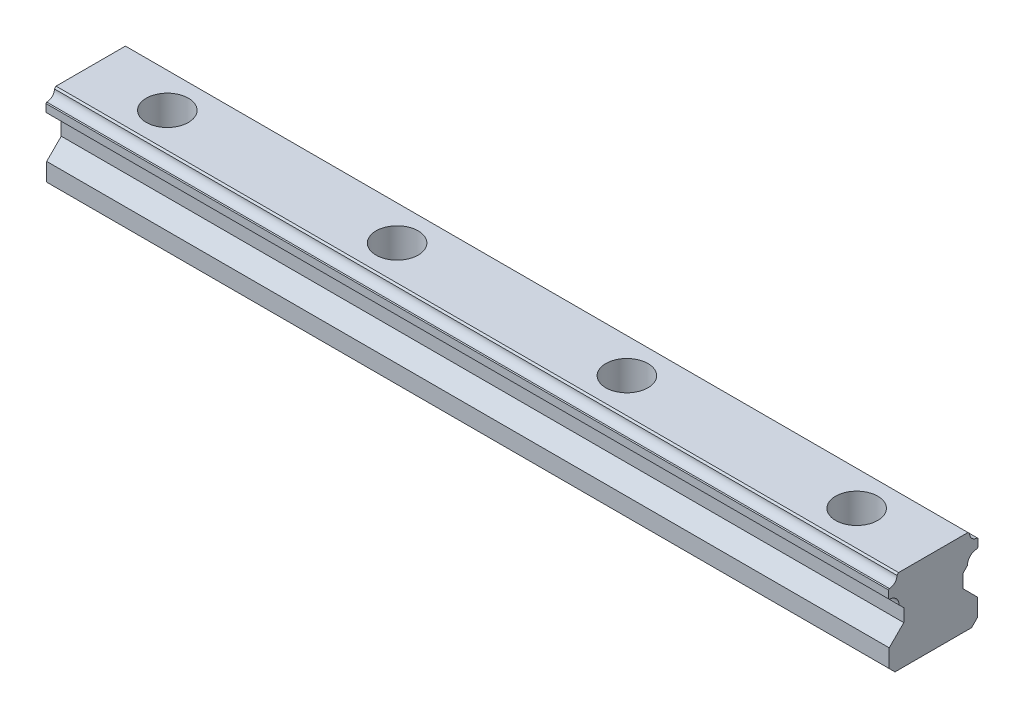
from build123d import *

# Parameters (mm, degrees)
BOSS_EXTRUDE1_DEPTH   = 220
BOLT_HOLE_D           = 7
BOLT_HOLE_CBORE_D     = 11
BOLT_HOLE_CBORE_DEPTH = 9
BOLT_PATTERN_COUNT    = 4
BOLT_PATTERN_PITCH    = 60


with BuildPart() as part:
    # Sketch1 → Boss-Extrude1 (new body)
    with BuildSketch(Plane(origin=(0, 0, 0), x_dir=(0, 0, -1), z_dir=(1, 0, 0))):
        with BuildLine():
            Line((-10, 0), (10, 0))
            Line((10, 0), (11.5, 1.5))
            Line((11.5, 1.5), (11.5, 6.2))
            Line((11.5, 6.2), (7.7, 10))
            Line((7.7, 10), (7.7, 13.38))
            Line((7.7, 13.38), (8.93, 14.61))
            ThreePointArc((8.93, 14.61), (9.671019844, 16.398980156), (11.46, 17.14))
            Line((11.46, 17.14), (11.68, 17.36))
            Line((11.68, 17.36), (11.68, 19.38))
            Line((11.68, 19.38), (11.47, 19.59))
            ThreePointArc((11.47, 19.59), (10.062857505, 20.172857505), (9.48, 21.58))
            Line((9.48, 21.58), (9.06, 22))
            Line((9.06, 22), (-9.06, 22))
            Line((-9.06, 22), (-9.48, 21.58))
            ThreePointArc((-9.48, 21.58), (-10.062857505, 20.172857505), (-11.47, 19.59))
            Line((-11.47, 19.59), (-11.68, 19.38))
            Line((-11.68, 19.38), (-11.68, 17.36))
            Line((-11.68, 17.36), (-11.46, 17.14))
            ThreePointArc((-11.46, 17.14), (-9.671019844, 16.398980156), (-8.93, 14.61))
            Line((-8.93, 14.61), (-7.7, 13.38))
            Line((-7.7, 13.38), (-7.7, 10))
            Line((-7.7, 10), (-11.5, 6.2))
            Line((-11.5, 6.2), (-11.5, 1.5))
            Line((-11.5, 1.5), (-10, 0))
        make_face()
    extrude(amount=BOSS_EXTRUDE1_DEPTH)

    # Bolt Hole (through all)
    with Locations(Plane(origin=(20, 22, 0), x_dir=(0, 0, 1), z_dir=(0, 1, 0))):
        with Locations((0, 0)):
            bolt_hole = CounterBoreHole(BOLT_HOLE_D / 2, BOLT_HOLE_CBORE_D / 2, BOLT_HOLE_CBORE_DEPTH)

    # Bolt Pattern: Bolt Hole ×4
    with Locations(*[(i * BOLT_PATTERN_PITCH, 0, 0) for i in range(1, BOLT_PATTERN_COUNT)]):
        add(bolt_hole, mode=Mode.SUBTRACT)


solid = part.part
